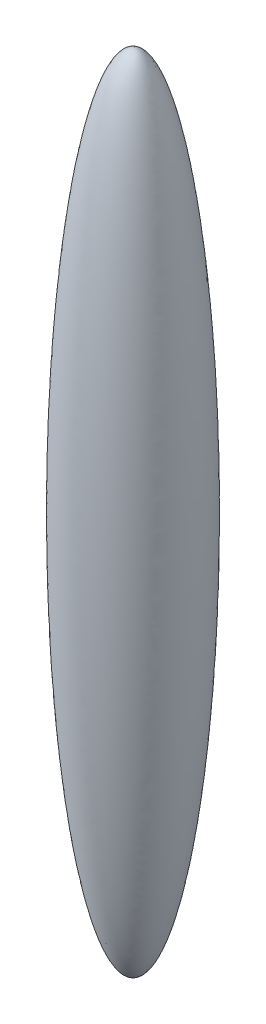
from build123d import *


with BuildPart() as part:
    # Sketch1 → Revolve2 (revolve)
    with BuildSketch(Plane.XY):
        with BuildLine():
            Line((0, 1000), (0, 0))
            add(Edge.make_bspline(
                [(0, 0), (76.2, 0), (76.2, 500), (76.2, 1000), (0, 1000)],
                knots=[3.141592654, 3.141592654, 3.141592654, 4.71238898, 4.71238898, 6.283185307, 6.283185307, 6.283185307], degree=2, weights=[1, 0.707106781, 1, 0.707106781, 1]))
        make_face()
    revolve(axis=Axis((0, 0, 0), (0, 1, 0)))


solid = part.part
